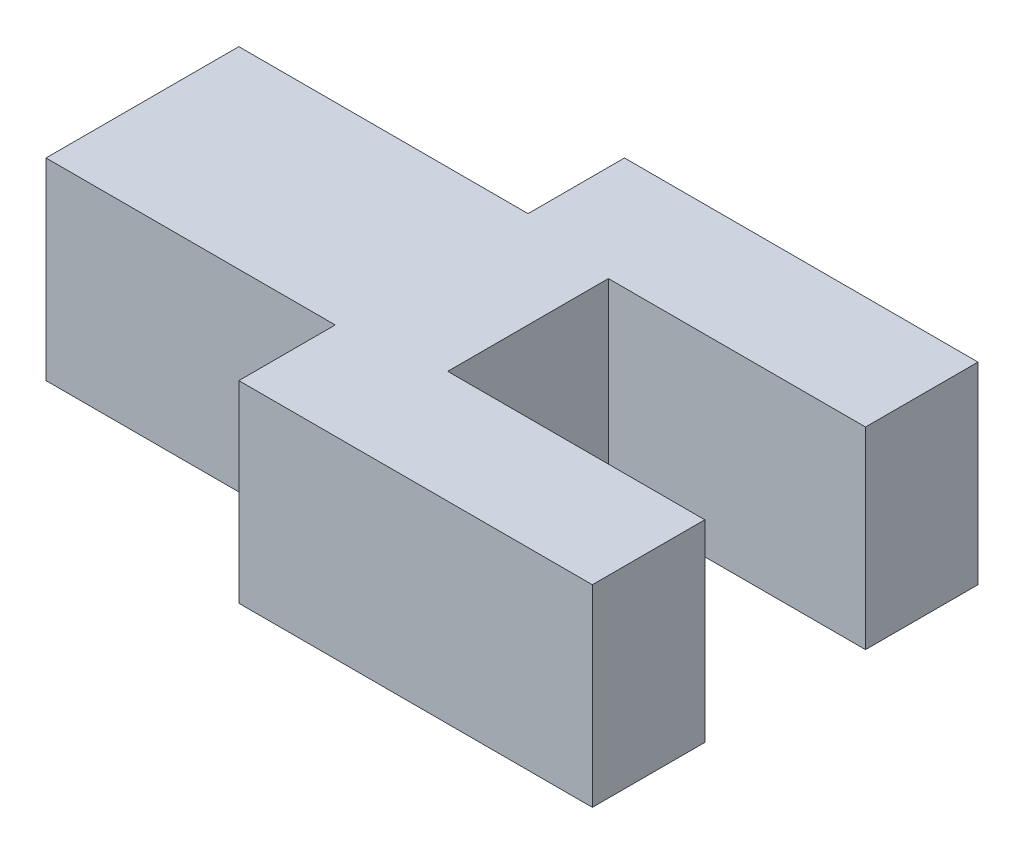
from build123d import *

# Parameters (mm, degrees)
BOSS_EXTRUDE1_DEPTH = 30


with BuildPart() as part:
    # Sketch1 → Boss-Extrude1 (new body)
    with BuildSketch(Plane(origin=(0, 0, 0), x_dir=(1, 0, 0), z_dir=(0, 1, 0))):
        Polygon((45, 12.5), (45, 30), (-10, 30), (-10, 15), (-55, 15), (-55, -15), (-10, -15), (-10, -30), (45, -30), (45, -12.5), (5, -12.5), (5, 12.5), align=None)
    extrude(amount=BOSS_EXTRUDE1_DEPTH)


solid = part.part
